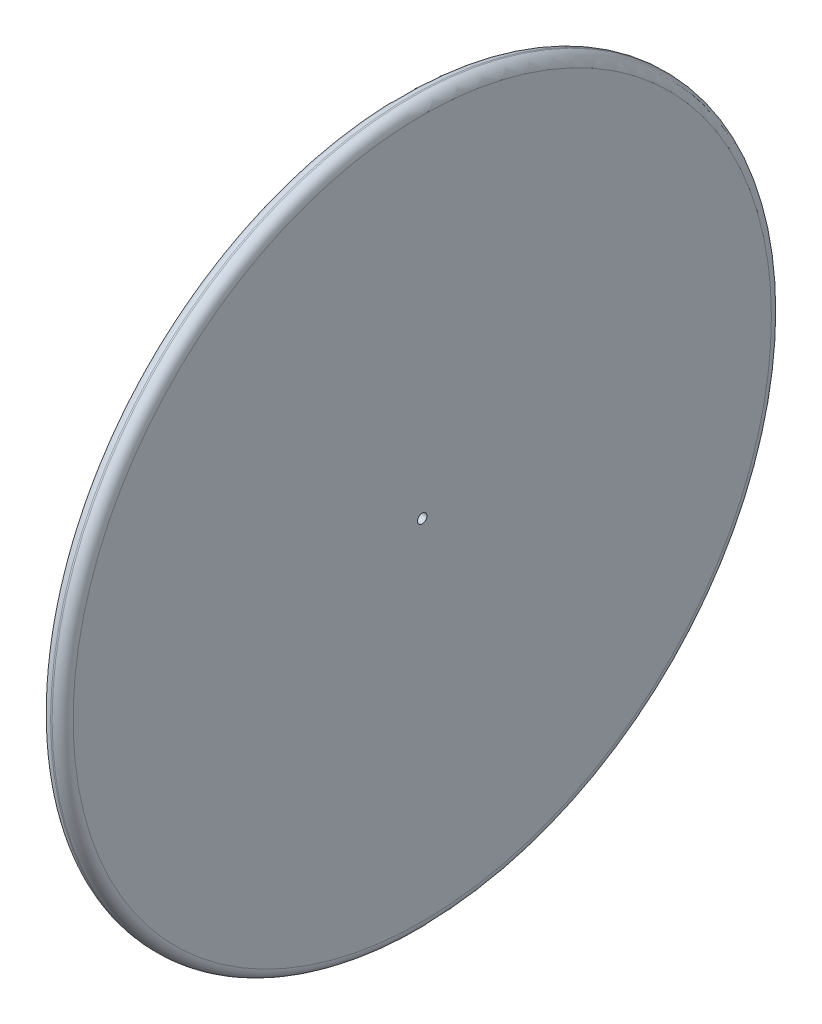
from build123d import *

# Parameters (mm, degrees)
SKETCH1_R           = 304.8
SKETCH1_R_2         = 3.9878
BOSS_EXTRUDE1_DEPTH = 19.05
FILLET4_R           = 8.89


with BuildPart() as part:
    # Sketch1 → Boss-Extrude1 (new body)
    with BuildSketch(Plane(origin=(0, 0, 0), x_dir=(0, 0, -1), z_dir=(1, 0, 0))):
        with Locations(Location((0, 0, 0), (0, 0, 180))):
            Circle(SKETCH1_R)
        with Locations(Location((0, 0, 0), (0, 0, 180))):
            Circle(SKETCH1_R_2, mode=Mode.SUBTRACT)
    extrude(amount=BOSS_EXTRUDE1_DEPTH)

    # Fillet4
    fillet4_edges = [part.edges().sort_by_distance(p)[0] for p in [
        (0, 0, -304.8),
        (19.05, 0, -304.8),
    ]]
    fillet(fillet4_edges, radius=FILLET4_R)


solid = part.part
